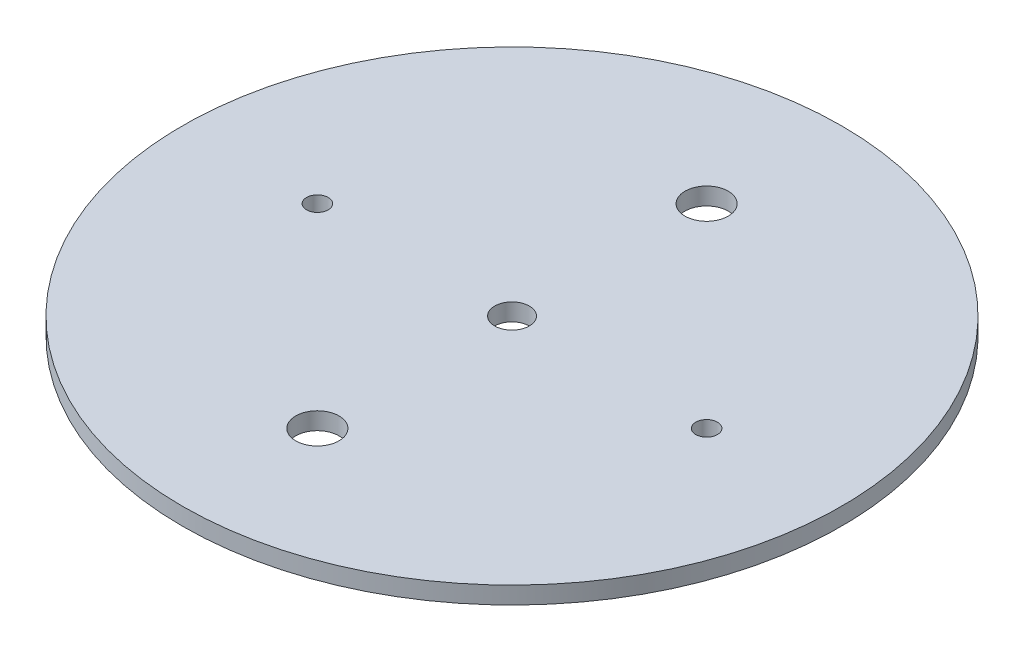
from build123d import *

# Parameters (mm, degrees)
SKETCH1_R           = 76.2
SKETCH1_R_2         = 2.5
SKETCH1_R_3         = 4
SKETCH1_R_4         = 5
BOSS_EXTRUDE1_DEPTH = 4


with BuildPart() as part:
    # Sketch1 → Boss-Extrude1 (new body)
    with BuildSketch(Plane(origin=(0, 0, 0), x_dir=(1, 0, 0), z_dir=(0, 1, 0))):
        with Locations(Location((0, 0, 0), (0, 0, 270))):
            Circle(SKETCH1_R)
        with Locations(Location((-45, 0, 0), (0, 0, 270))):
            Circle(SKETCH1_R_2, mode=Mode.SUBTRACT)
        with Locations(Location((45, 0, 0), (0, 0, 270))):
            Circle(SKETCH1_R_2, mode=Mode.SUBTRACT)
        with Locations(Location((0, 0, 0), (0, 0, 270))):
            Circle(SKETCH1_R_3, mode=Mode.SUBTRACT)
        with Locations(Location((0, -45, 0), (0, 0, 270))):
            Circle(SKETCH1_R_4, mode=Mode.SUBTRACT)
        with Locations(Location((0, 45, 0), (0, 0, 270))):
            Circle(SKETCH1_R_4, mode=Mode.SUBTRACT)
    extrude(amount=BOSS_EXTRUDE1_DEPTH)


solid = part.part
